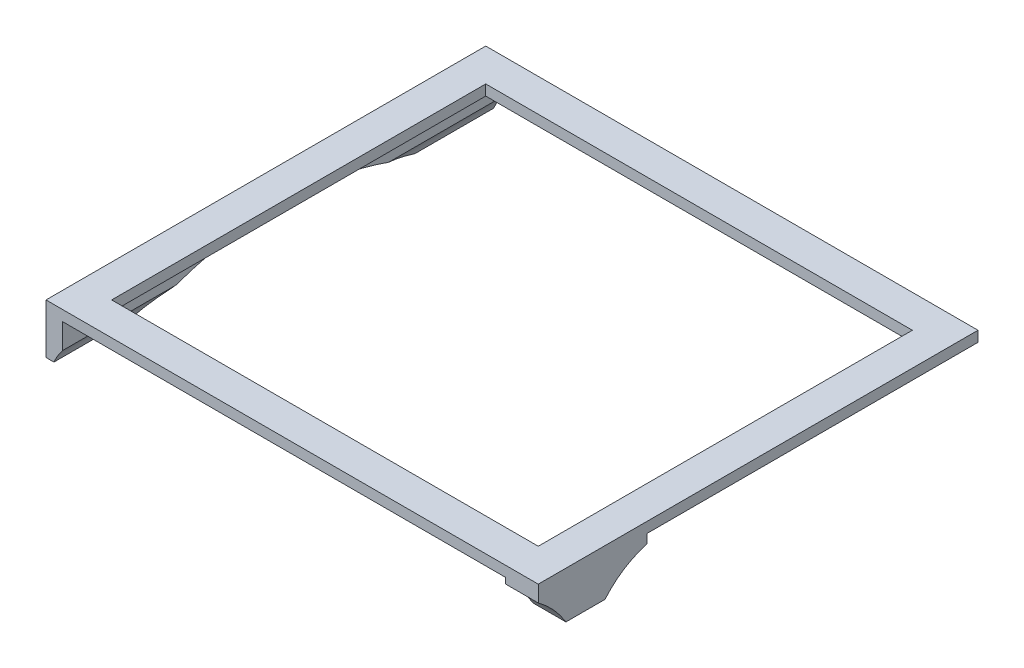
from build123d import *

# Parameters (mm, degrees)
SKETCH1_W           = 75
SKETCH1_H           = 67
SKETCH1_W_2         = 65
SKETCH1_H_2         = 57
BOSS_EXTRUDE1_DEPTH = 1.6
SKETCH2_W           = 5
SKETCH2_H           = 16.553638176
BOSS_EXTRUDE2_DEPTH = 5.5
SKETCH3_W           = 2.5
SKETCH3_H           = 67
BOSS_EXTRUDE3_DEPTH = 6
CUT_EXTRUDE1_REACH  = 102.747
CUT_EXTRUDE2_REACH  = 102.747
CUT_EXTRUDE3_REACH  = 102.747


with BuildPart() as part:
    # Sketch1 → Boss-Extrude1 (new body)
    with BuildSketch(Plane(origin=(0, 0, 0), x_dir=(1, 0, 0), z_dir=(0, 1, 0))):
        with Locations((37.5, 33.5)):
            Rectangle(SKETCH1_W, SKETCH1_H)
        with Locations((37.5, 33.5)):
            Rectangle(SKETCH1_W_2, SKETCH1_H_2, mode=Mode.SUBTRACT)
    extrude(amount=BOSS_EXTRUDE1_DEPTH)

    # Sketch2 → Boss-Extrude2 (add)
    with BuildSketch(Plane(origin=(0, 0, 0), x_dir=(-1, 0, 0), z_dir=(0, -1, 0))):
        with Locations((-72.5, 8.276819088)):
            Rectangle(SKETCH2_W, SKETCH2_H)
    extrude(amount=BOSS_EXTRUDE2_DEPTH)

    # Sketch3 → Boss-Extrude3 (add)
    with BuildSketch(Plane(origin=(0, 0, 0), x_dir=(-1, 0, 0), z_dir=(0, -1, 0))):
        with Locations((-1.25, 33.5)):
            Rectangle(SKETCH3_W, SKETCH3_H)
    extrude(amount=BOSS_EXTRUDE3_DEPTH)

    # Sketch4 → Cut-Extrude1 (cut, up to next)
    with BuildSketch(Plane.XY, mode=Mode.PRIVATE) as cut_extrude1_sk1:
        with BuildLine():
            Line((2.5, -3.843145751), (2.5, -6))
            Line((2.5, -6), (1.208438024, -6))
            ThreePointArc((1.208438024, -6), (1.778538223, -4.876253897), (2.5, -3.843145751))
        make_face()
    cut_extrude1_tool1 = extrude(cut_extrude1_sk1.sketch, amount=-CUT_EXTRUDE1_REACH, mode=Mode.PRIVATE) & part.part
    add(cut_extrude1_tool1.solids().sort_by_distance((2.045896, -5.244781, 0))[0], mode=Mode.SUBTRACT)

    # Sketch5 → Cut-Extrude2 (cut, up to next)
    with BuildSketch(Plane.ZY, mode=Mode.PRIVATE) as cut_extrude2_sk1:
        with BuildLine():
            Line((-12, -6), (-55, -6))
            add(Edge.make_bspline(
                [(-55, -6), (-33.5, 4), (-12, -6)],
                knots=[0, 0, 0, 1, 1, 1], degree=2))
        make_face()
    cut_extrude2_tool1 = extrude(cut_extrude2_sk1.sketch, amount=-CUT_EXTRUDE2_REACH, mode=Mode.PRIVATE) & part.part
    add(cut_extrude2_tool1.solids().sort_by_distance((0, -4, -33.5))[0], mode=Mode.SUBTRACT)

    # Sketch6 → Cut-Extrude3 (cut, up to next)
    with BuildSketch(Plane(origin=(75, 0, 0), x_dir=(0, 0, -1), z_dir=(1, 0, 0)), mode=Mode.PRIVATE) as cut_extrude3_sk1:
        with BuildLine():
            Line((16.553638176, -1.377553515), (16.553638176, -5.5))
            Line((16.553638176, -5.5), (10.16876266, -5.5))
            ThreePointArc((10.16876266, -5.5), (13.054139073, -2.963197882), (16.553638176, -1.377553515))
        make_face()
    cut_extrude3_tool1 = extrude(cut_extrude3_sk1.sketch, amount=-CUT_EXTRUDE3_REACH, mode=Mode.PRIVATE) & part.part
    # Sketch6 → Cut-Extrude3 (cut, up to next)
    with BuildSketch(Plane(origin=(75, 0, 0), x_dir=(0, 0, -1), z_dir=(1, 0, 0)), mode=Mode.PRIVATE) as cut_extrude3_sk2:
        with BuildLine():
            Line((4.215785495, -5.5), (0, -5.5))
            Line((0, -5.5), (0, -0.880945509))
            ThreePointArc((0, -0.880945509), (2.338832837, -2.979695012), (4.215785495, -5.5))
        make_face()
    cut_extrude3_tool2 = extrude(cut_extrude3_sk2.sketch, amount=-CUT_EXTRUDE3_REACH, mode=Mode.PRIVATE) & part.part
    add(cut_extrude3_tool1.solids().sort_by_distance((75, -3.96823, -14.212135))[0], mode=Mode.SUBTRACT)
    add(cut_extrude3_tool2.solids().sort_by_distance((75, -3.859275, -1.499307))[0], mode=Mode.SUBTRACT)


solid = part.part
